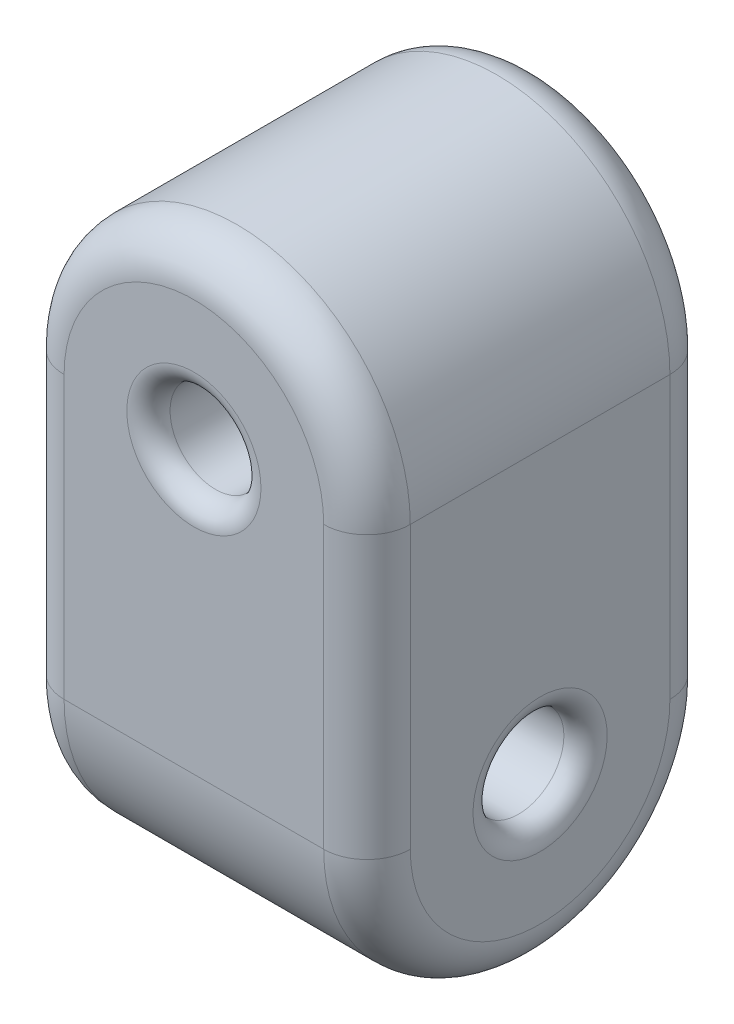
from build123d import *

# Parameters (mm, degrees)
BOSS_EXTRUDE1_START = 0.8
SKETCH2_R           = 4
BOSS_EXTRUDE1_DEPTH = 8
SKETCH10_W          = 8
SKETCH10_H          = 6.5
BOSS_EXTRUDE2_DEPTH = 8
BOSS_EXTRUDE3_START = 4
SKETCH8_R           = 4
BOSS_EXTRUDE3_DEPTH = 8
SKETCH1_R           = 1.05
CUT_EXTRUDE2_DEPTH  = 9.6
CUT_EXTRUDE3_START  = 4.975
SKETCH9_R           = 1.05
CUT_EXTRUDE3_DEPTH  = 9.95
FILLET1_R           = 1
FILLET2_R           = 0.5


with BuildPart() as part:
    # Sketch2 → Boss-Extrude1 (new body)
    with BuildSketch(Plane.XY.offset(BOSS_EXTRUDE1_START)):
        Circle(SKETCH2_R)
    extrude(amount=BOSS_EXTRUDE1_DEPTH)

    # Sketch10 → Boss-Extrude2 (add)
    with BuildSketch(Plane(origin=(0, 0, 0.8), x_dir=(-1, 0, 0), z_dir=(0, 0, -1))):
        with Locations((0, -3.25)):
            Rectangle(SKETCH10_W, SKETCH10_H)
    extrude(amount=-BOSS_EXTRUDE2_DEPTH)

    # Sketch8 → Boss-Extrude3 (add)
    with BuildSketch(Plane(origin=(0, 0, 0), x_dir=(0, 0, -1), z_dir=(1, 0, 0)).offset(BOSS_EXTRUDE3_START)):
        with Locations((-4.8, -6.5)):
            Circle(SKETCH8_R)
    extrude(amount=-BOSS_EXTRUDE3_DEPTH)

    # Sketch1 → Cut-Extrude2 (cut)
    with BuildSketch(Plane.XY):
        Circle(SKETCH1_R)
    extrude(amount=CUT_EXTRUDE2_DEPTH, mode=Mode.SUBTRACT)

    # Sketch9 → Cut-Extrude3 (cut)
    with BuildSketch(Plane(origin=(0, 0, 0), x_dir=(0, 0, -1), z_dir=(1, 0, 0)).offset(CUT_EXTRUDE3_START)):
        with Locations((-4.8, -6.5)):
            Circle(SKETCH9_R)
    extrude(amount=-CUT_EXTRUDE3_DEPTH, mode=Mode.SUBTRACT)

    # Fillet1
    fillet1_edges = [part.edges().sort_by_distance(p)[0] for p in [
        (-4, -3.25, 8.8),
        (4, -3.25, 0.8),
        (0, 4, 0.8),
        (-4, -10.5, 4.8),
        (4, -10.5, 4.8),
        (0, 4, 8.8),
        (-4, -3.25, 0.8),
        (4, -3.25, 8.8),
    ]]
    fillet(fillet1_edges, radius=FILLET1_R)

    # Fillet2
    fillet2_edges = [part.edges().sort_by_distance(p)[0] for p in [
        (-1.05, 0, 8.8),
        (-1.05, 0, 0.8),
        (-4, -6.5, 5.85),
        (4, -6.5, 5.85),
    ]]
    fillet(fillet2_edges, radius=FILLET2_R)


solid = part.part
